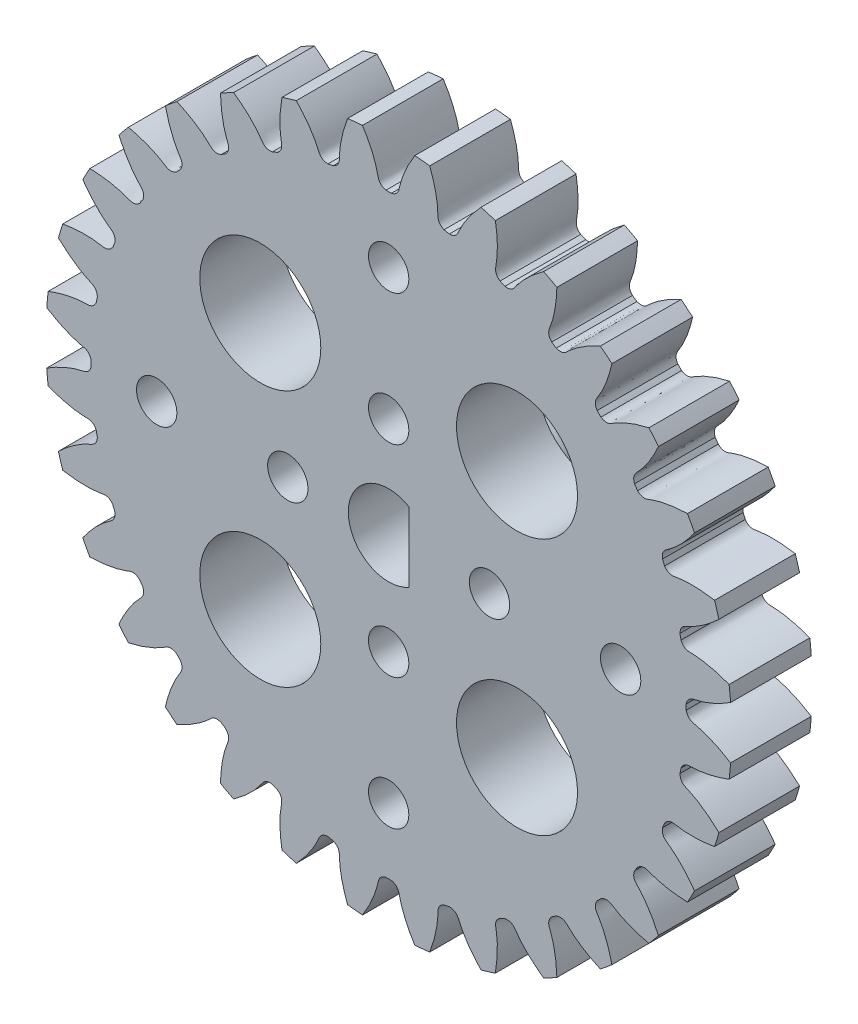
from build123d import *

# Parameters (mm, degrees)
SKETCH_1_R      = 2
SKETCH_1_R_2    = 1
SKETCH_1_R_3    = 3
EXTRUDE_1_DEPTH = 4
EXTRUDE_START   = -8
SKETCH_2_R      = 3.25
EXTRUDE_2_DEPTH = 8


with BuildPart() as part:
    # 草图1 → 凸台-拉伸1 (new body)
    with BuildSketch(Plane.XY):
        with BuildLine():
            ThreePointArc((-500.862133086, -21.020334667), (-500.887684173, -20.888759136), (-500.914429822, -20.757421219))
            add(Edge.make_bspline(
                [(-500.914429822, -20.757421219), (-500.899514244, -20.392716239), (-500.651028529, -20.323354985), (-500.400528124, -20.207194988), (-500.340474134, -20.17798022), (-500.250507683, -20.13192645), (-500.126698388, -20.063635499), (-499.966068811, -19.966494694), (-499.789360259, -19.849770094), (-499.597915128, -19.712040415), (-499.393161686, -19.55196308), (-499.185486348, -19.37580509), (-499.048497435, -19.250456147), (-498.982413871, -19.187867496)],
                knots=[0, 0, 0, 0, 0.124532679, 0.135328735, 0.147193327, 0.160126453, 0.189198313, 0.222544314, 0.260164456, 0.302058739, 0.348227164, 0.39866973, 0.447184516, 0.447184516, 0.447184516, 0.447184516], degree=3))
            ThreePointArc((-498.982413871, -19.187867496), (-499.086281352, -18.831501873), (-499.19790483, -18.477489006))
            add(Edge.make_bspline(
                [(-501.676314712, -18.245823332), (-501.461293631, -18.54077779), (-501.216150262, -18.460398297), (-500.943331751, -18.417811237), (-500.877167827, -18.40873822), (-500.776777353, -18.397047848), (-500.635893267, -18.385044939), (-500.448366115, -18.376573555), (-500.236589611, -18.375452502), (-500.000890292, -18.383609329), (-499.741709825, -18.402953851), (-499.471165957, -18.434045631), (-499.287623697, -18.462162506), (-499.19790483, -18.477489006)],
                knots=[0, 0, 0, 0, 0.124532679, 0.135328735, 0.147193327, 0.160126453, 0.189198313, 0.222544314, 0.260164456, 0.302058739, 0.348227164, 0.39866973, 0.447184516, 0.447184516, 0.447184516, 0.447184516], degree=3))
            ThreePointArc((-501.676314712, -18.245823332), (-501.727043955, -18.121760759), (-501.77889845, -17.99816428))
            add(Edge.make_bspline(
                [(-501.77889845, -17.99816428), (-501.835419883, -17.637557119), (-501.60524046, -17.521051464), (-501.382215042, -17.358253244), (-501.32901449, -17.317883877), (-501.249761364, -17.255163433), (-501.141653934, -17.164030679), (-501.00306204, -17.037419131), (-500.852520733, -16.888463233), (-500.691623894, -16.716030899), (-500.522034271, -16.519083991), (-500.352716075, -16.305795378), (-500.242813732, -16.156129769), (-500.190210384, -16.081851477)],
                knots=[0, 0, 0, 0, 0.124532679, 0.135328735, 0.147193327, 0.160126453, 0.189198313, 0.222544314, 0.260164456, 0.302058739, 0.348227164, 0.39866973, 0.447184516, 0.447184516, 0.447184516, 0.447184516], degree=3))
            ThreePointArc((-500.190210384, -16.081851477), (-500.361605565, -15.75259686), (-500.540148714, -15.427162911))
            add(Edge.make_bspline(
                [(-503.016132376, -15.683462411), (-502.747700105, -15.930800869), (-502.522948357, -15.804140747), (-502.263680301, -15.709147734), (-502.200557757, -15.687341111), (-502.104376936, -15.656290157), (-501.968541549, -15.617032759), (-501.786270364, -15.572139418), (-501.578781793, -15.529724359), (-501.346020052, -15.491741799), (-501.088045736, -15.46015102), (-500.816634587, -15.43786489), (-500.63113371, -15.429634188), (-500.540148714, -15.427162911)],
                knots=[0, 0, 0, 0, 0.124532679, 0.135328735, 0.147193327, 0.160126453, 0.189198313, 0.222544314, 0.260164456, 0.302058739, 0.348227164, 0.39866973, 0.447184516, 0.447184516, 0.447184516, 0.447184516], degree=3))
            ThreePointArc((-503.016132376, -15.683462411), (-503.090090278, -15.571680449), (-503.165060881, -15.460575152))
            add(Edge.make_bspline(
                [(-503.165060881, -15.460575152), (-503.290847237, -15.117923741), (-503.087819773, -14.958750932), (-502.900840082, -14.755570733), (-502.856537438, -14.70559814), (-502.79104329, -14.628621334), (-502.702792232, -14.518148957), (-502.59156403, -14.366932277), (-502.472975186, -14.191469373), (-502.348809815, -13.990960861), (-502.220901244, -13.764712938), (-502.096446994, -13.522490266), (-502.017854705, -13.354259555), (-501.980753092, -13.271146096)],
                knots=[0, 0, 0, 0, 0.124532679, 0.135328735, 0.147193327, 0.160126453, 0.189198313, 0.222544314, 0.260164456, 0.302058739, 0.348227164, 0.39866973, 0.447184516, 0.447184516, 0.447184516, 0.447184516], degree=3))
            ThreePointArc((-501.980753092, -13.271146096), (-502.213089352, -12.981655555), (-502.451690858, -12.697306769))
            add(Edge.make_bspline(
                [(-504.830097636, -13.431721995), (-504.518569876, -13.621939376), (-504.322846835, -13.453866102), (-504.087092759, -13.310117665), (-504.029437358, -13.276415452), (-503.941162365, -13.227197186), (-503.815595756, -13.162193939), (-503.645585117, -13.082603867), (-503.450358148, -13.000524789), (-503.229478888, -12.91786249), (-502.982624532, -12.836550427), (-502.72077628, -12.76174283), (-502.54044548, -12.717480853), (-502.451690858, -12.697306769)],
                knots=[0, 0, 0, 0, 0.124532679, 0.135328735, 0.147193327, 0.160126453, 0.189198313, 0.222544314, 0.260164456, 0.302058739, 0.348227164, 0.39866973, 0.447184516, 0.447184516, 0.447184516, 0.447184516], degree=3))
            ThreePointArc((-504.830097636, -13.431721995), (-504.924442037, -13.336516364), (-505.019647668, -13.242171963))
            add(Edge.make_bspline(
                [(-505.019647668, -13.242171963), (-505.209865049, -12.930644203), (-505.041791776, -12.734921162), (-504.898043338, -12.499167086), (-504.864341126, -12.441511685), (-504.815122859, -12.353236692), (-504.750119612, -12.227670083), (-504.67052954, -12.057659443), (-504.588450462, -11.862432474), (-504.505788163, -11.641553215), (-504.4244761, -11.394698858), (-504.349668503, -11.132850607), (-504.305406527, -10.952519807), (-504.285232442, -10.863765185)],
                knots=[0, 0, 0, 0, 0.124532679, 0.135328735, 0.147193327, 0.160126453, 0.189198313, 0.222544314, 0.260164456, 0.302058739, 0.348227164, 0.39866973, 0.447184516, 0.447184516, 0.447184516, 0.447184516], degree=3))
            ThreePointArc((-504.285232442, -10.863765185), (-504.569581229, -10.625163679), (-504.859071769, -10.392827419))
            add(Edge.make_bspline(
                [(-507.048500826, -11.577135207), (-506.705849414, -11.702921564), (-506.546676605, -11.499894099), (-506.343496406, -11.312914409), (-506.293523813, -11.268611765), (-506.216547007, -11.203117617), (-506.10607463, -11.114866559), (-505.95485795, -11.003638357), (-505.779395046, -10.885049513), (-505.578886535, -10.760884141), (-505.352638611, -10.632975571), (-505.110415939, -10.508521321), (-504.942185228, -10.429929032), (-504.859071769, -10.392827419)],
                knots=[0, 0, 0, 0, 0.124532679, 0.135328735, 0.147193327, 0.160126453, 0.189198313, 0.222544314, 0.260164456, 0.302058739, 0.348227164, 0.39866973, 0.447184516, 0.447184516, 0.447184516, 0.447184516], degree=3))
            ThreePointArc((-507.048500826, -11.577135207), (-507.159606122, -11.502164605), (-507.271388084, -11.428206703))
            add(Edge.make_bspline(
                [(-507.271388084, -11.428206703), (-507.518726542, -11.159774432), (-507.39206642, -10.935022684), (-507.297073407, -10.675754628), (-507.275266784, -10.612632083), (-507.24421583, -10.516451263), (-507.204958432, -10.380615876), (-507.160065091, -10.198344691), (-507.117650032, -9.990856119), (-507.079667472, -9.758094379), (-507.048076693, -9.500120063), (-507.025790563, -9.228708913), (-507.017559862, -9.043208037), (-507.015088584, -8.95222304)],
                knots=[0, 0, 0, 0, 0.124532679, 0.135328735, 0.147193327, 0.160126453, 0.189198313, 0.222544314, 0.260164456, 0.302058739, 0.348227164, 0.39866973, 0.447184516, 0.447184516, 0.447184516, 0.447184516], degree=3))
            ThreePointArc((-507.015088584, -8.95222304), (-507.340522533, -8.773679892), (-507.66977715, -8.602284711))
            add(Edge.make_bspline(
                [(-509.586089953, -10.190972777), (-509.225482792, -10.24749421), (-509.108977137, -10.017314787), (-508.946178917, -9.794289368), (-508.90580955, -9.741088817), (-508.843089107, -9.661835691), (-508.751956352, -9.553728261), (-508.625344804, -9.415136367), (-508.476388907, -9.26459506), (-508.303956572, -9.103698221), (-508.107009664, -8.934108598), (-507.893721051, -8.764790402), (-507.744055442, -8.654888059), (-507.66977715, -8.602284711)],
                knots=[0, 0, 0, 0, 0.124532679, 0.135328735, 0.147193327, 0.160126453, 0.189198313, 0.222544314, 0.260164456, 0.302058739, 0.348227164, 0.39866973, 0.447184516, 0.447184516, 0.447184516, 0.447184516], degree=3))
            ThreePointArc((-509.586089953, -10.190972777), (-509.709686432, -10.139118282), (-509.833749005, -10.088389039))
            add(Edge.make_bspline(
                [(-509.833749005, -10.088389039), (-510.128703463, -9.873367958), (-510.048323971, -9.628224588), (-510.00573691, -9.355406077), (-509.996663893, -9.289242154), (-509.984973521, -9.18885168), (-509.972970612, -9.047967594), (-509.964499229, -8.860440442), (-509.963378175, -8.648663938), (-509.971535002, -8.412964619), (-509.990879524, -8.153784152), (-510.021971304, -7.883240283), (-510.050088179, -7.699698024), (-510.065414679, -7.609979156)],
                knots=[0, 0, 0, 0, 0.124532679, 0.135328735, 0.147193327, 0.160126453, 0.189198313, 0.222544314, 0.260164456, 0.302058739, 0.348227164, 0.39866973, 0.447184516, 0.447184516, 0.447184516, 0.447184516], degree=3))
            ThreePointArc((-510.065414679, -7.609979156), (-510.419427546, -7.498355679), (-510.775793169, -7.394488197))
            add(Edge.make_bspline(
                [(-512.345346892, -9.326504149), (-511.980641912, -9.311588571), (-511.911280659, -9.063102855), (-511.795120661, -8.812602451), (-511.765905893, -8.752548461), (-511.719852123, -8.66258201), (-511.651561172, -8.538772715), (-511.554420367, -8.378143138), (-511.437695767, -8.201434586), (-511.299966088, -8.009989455), (-511.139888753, -7.805236013), (-510.963730763, -7.597560675), (-510.83838182, -7.460571762), (-510.775793169, -7.394488197)],
                knots=[0, 0, 0, 0, 0.124532679, 0.135328735, 0.147193327, 0.160126453, 0.189198313, 0.222544314, 0.260164456, 0.302058739, 0.348227164, 0.39866973, 0.447184516, 0.447184516, 0.447184516, 0.447184516], degree=3))
            ThreePointArc((-512.345346892, -9.326504149), (-512.47668481, -9.2997585), (-512.60826034, -9.274207413))
            add(Edge.make_bspline(
                [(-512.60826034, -9.274207413), (-512.939495862, -9.120860662), (-512.908485938, -8.864746393), (-512.919941427, -8.588861689), (-512.923950686, -8.522199029), (-512.932070152, -8.421456852), (-512.947782997, -8.280938163), (-512.976059121, -8.095361607), (-513.016275155, -7.887435623), (-513.070257907, -7.657856518), (-513.13979433, -7.40743006), (-513.22306918, -7.148150321), (-513.286453116, -6.973620105), (-513.318988404, -6.888615212)],
                knots=[0, 0, 0, 0, 0.124532679, 0.135328735, 0.147193327, 0.160126453, 0.189198313, 0.222544314, 0.260164456, 0.302058739, 0.348227164, 0.39866973, 0.447184516, 0.447184516, 0.447184516, 0.447184516], degree=3))
            ThreePointArc((-513.318988404, -6.888615212), (-513.687975674, -6.848201033), (-514.057757371, -6.81585282))
            add(Edge.make_bspline(
                [(-515.220234946, -9.016950368), (-514.865447555, -8.931170977), (-514.845896216, -8.673928135), (-514.780838405, -8.405579335), (-514.763900943, -8.340979747), (-514.736283667, -8.243757331), (-514.693458903, -8.109004093), (-514.629521907, -7.932509737), (-514.549514266, -7.736424751), (-514.451780116, -7.521788457), (-514.334724038, -7.289739756), (-514.202466323, -7.051688122), (-514.106251135, -6.892877048), (-514.057757371, -6.81585282)],
                knots=[0, 0, 0, 0, 0.124532679, 0.135328735, 0.147193327, 0.160126453, 0.189198313, 0.222544314, 0.260164456, 0.302058739, 0.348227164, 0.39866973, 0.447184516, 0.447184516, 0.447184516, 0.447184516], degree=3))
            ThreePointArc((-515.220234946, -9.016950368), (-515.354267059, -9.016341386), (-515.488299173, -9.016950368))
            add(Edge.make_bspline(
                [(-515.488299173, -9.016950368), (-515.843086564, -8.931170977), (-515.862637902, -8.673928135), (-515.927695713, -8.405579335), (-515.944633175, -8.340979747), (-515.972250451, -8.243757331), (-516.015075215, -8.109004093), (-516.079012211, -7.932509737), (-516.159019852, -7.736424751), (-516.256754002, -7.521788457), (-516.373810081, -7.289739756), (-516.506067796, -7.051688122), (-516.602282984, -6.892877048), (-516.650776747, -6.81585282)],
                knots=[0, 0, 0, 0, 0.124532679, 0.135328735, 0.147193327, 0.160126453, 0.189198313, 0.222544314, 0.260164456, 0.302058739, 0.348227164, 0.39866973, 0.447184516, 0.447184516, 0.447184516, 0.447184516], degree=3))
            ThreePointArc((-516.650776747, -6.81585282), (-517.020558445, -6.848201033), (-517.389545714, -6.888615212))
            add(Edge.make_bspline(
                [(-518.100273779, -9.274207413), (-517.769038257, -9.120860662), (-517.800048181, -8.864746393), (-517.788592691, -8.588861689), (-517.784583432, -8.522199029), (-517.776463967, -8.421456852), (-517.760751121, -8.280938163), (-517.732474997, -8.095361607), (-517.692258964, -7.887435623), (-517.638276212, -7.657856518), (-517.568739789, -7.40743006), (-517.485464938, -7.148150321), (-517.422081002, -6.973620105), (-517.389545714, -6.888615212)],
                knots=[0, 0, 0, 0, 0.124532679, 0.135328735, 0.147193327, 0.160126453, 0.189198313, 0.222544314, 0.260164456, 0.302058739, 0.348227164, 0.39866973, 0.447184516, 0.447184516, 0.447184516, 0.447184516], degree=3))
            ThreePointArc((-518.100273779, -9.274207413), (-518.231849309, -9.2997585), (-518.363187226, -9.326504149))
            add(Edge.make_bspline(
                [(-518.363187226, -9.326504149), (-518.727892206, -9.311588571), (-518.79725346, -9.063102855), (-518.913413457, -8.812602451), (-518.942628225, -8.752548461), (-518.988681995, -8.66258201), (-519.056972946, -8.538772715), (-519.154113752, -8.378143138), (-519.270838351, -8.201434586), (-519.408568031, -8.009989455), (-519.568645365, -7.805236013), (-519.744803355, -7.597560675), (-519.870152299, -7.460571762), (-519.93274095, -7.394488197)],
                knots=[0, 0, 0, 0, 0.124532679, 0.135328735, 0.147193327, 0.160126453, 0.189198313, 0.222544314, 0.260164456, 0.302058739, 0.348227164, 0.39866973, 0.447184516, 0.447184516, 0.447184516, 0.447184516], degree=3))
            ThreePointArc((-519.93274095, -7.394488197), (-520.289106573, -7.498355679), (-520.64311944, -7.609979156))
            add(Edge.make_bspline(
                [(-520.874785113, -10.088389039), (-520.579830656, -9.873367958), (-520.660210148, -9.628224588), (-520.702797208, -9.355406077), (-520.711870226, -9.289242154), (-520.723560598, -9.18885168), (-520.735563506, -9.047967594), (-520.74403489, -8.860440442), (-520.745155944, -8.648663938), (-520.736999116, -8.412964619), (-520.717654595, -8.153784152), (-520.686562815, -7.883240283), (-520.65844594, -7.699698024), (-520.64311944, -7.609979156)],
                knots=[0, 0, 0, 0, 0.124532679, 0.135328735, 0.147193327, 0.160126453, 0.189198313, 0.222544314, 0.260164456, 0.302058739, 0.348227164, 0.39866973, 0.447184516, 0.447184516, 0.447184516, 0.447184516], degree=3))
            ThreePointArc((-520.874785113, -10.088389039), (-520.998847687, -10.139118282), (-521.122444165, -10.190972777))
            add(Edge.make_bspline(
                [(-521.122444165, -10.190972777), (-521.483051327, -10.24749421), (-521.599556982, -10.017314787), (-521.762355202, -9.794289368), (-521.802724568, -9.741088817), (-521.865445012, -9.661835691), (-521.956577766, -9.553728261), (-522.083189314, -9.415136367), (-522.232145212, -9.26459506), (-522.404577547, -9.103698221), (-522.601524455, -8.934108598), (-522.814813067, -8.764790402), (-522.964478677, -8.654888059), (-523.038756968, -8.602284711)],
                knots=[0, 0, 0, 0, 0.124532679, 0.135328735, 0.147193327, 0.160126453, 0.189198313, 0.222544314, 0.260164456, 0.302058739, 0.348227164, 0.39866973, 0.447184516, 0.447184516, 0.447184516, 0.447184516], degree=3))
            ThreePointArc((-523.038756968, -8.602284711), (-523.368011585, -8.773679892), (-523.693445534, -8.95222304))
            add(Edge.make_bspline(
                [(-523.437146035, -11.428206703), (-523.189807577, -11.159774432), (-523.316467698, -10.935022684), (-523.411460711, -10.675754628), (-523.433267334, -10.612632083), (-523.464318289, -10.516451263), (-523.503575687, -10.380615876), (-523.548469028, -10.198344691), (-523.590884087, -9.990856119), (-523.628866647, -9.758094379), (-523.660457425, -9.500120063), (-523.682743556, -9.228708913), (-523.690974257, -9.043208037), (-523.693445534, -8.95222304)],
                knots=[0, 0, 0, 0, 0.124532679, 0.135328735, 0.147193327, 0.160126453, 0.189198313, 0.222544314, 0.260164456, 0.302058739, 0.348227164, 0.39866973, 0.447184516, 0.447184516, 0.447184516, 0.447184516], degree=3))
            ThreePointArc((-523.437146035, -11.428206703), (-523.548927996, -11.502164605), (-523.660033293, -11.577135207))
            add(Edge.make_bspline(
                [(-523.660033293, -11.577135207), (-524.002684704, -11.702921564), (-524.161857514, -11.499894099), (-524.365037712, -11.312914409), (-524.415010305, -11.268611765), (-524.491987111, -11.203117617), (-524.602459489, -11.114866559), (-524.753676169, -11.003638357), (-524.929139073, -10.885049513), (-525.129647584, -10.760884141), (-525.355895507, -10.632975571), (-525.59811818, -10.508521321), (-525.76634889, -10.429929032), (-525.849462349, -10.392827419)],
                knots=[0, 0, 0, 0, 0.124532679, 0.135328735, 0.147193327, 0.160126453, 0.189198313, 0.222544314, 0.260164456, 0.302058739, 0.348227164, 0.39866973, 0.447184516, 0.447184516, 0.447184516, 0.447184516], degree=3))
            ThreePointArc((-525.849462349, -10.392827419), (-526.13895289, -10.625163679), (-526.423301677, -10.863765185))
            add(Edge.make_bspline(
                [(-525.68888645, -13.242171963), (-525.498669069, -12.930644203), (-525.666742343, -12.734921162), (-525.810490781, -12.499167086), (-525.844192993, -12.441511685), (-525.893411259, -12.353236692), (-525.958414506, -12.227670083), (-526.038004579, -12.057659443), (-526.120083657, -11.862432474), (-526.202745956, -11.641553215), (-526.284058019, -11.394698858), (-526.358865616, -11.132850607), (-526.403127592, -10.952519807), (-526.423301677, -10.863765185)],
                knots=[0, 0, 0, 0, 0.124532679, 0.135328735, 0.147193327, 0.160126453, 0.189198313, 0.222544314, 0.260164456, 0.302058739, 0.348227164, 0.39866973, 0.447184516, 0.447184516, 0.447184516, 0.447184516], degree=3))
            ThreePointArc((-525.68888645, -13.242171963), (-525.784092082, -13.336516364), (-525.878436482, -13.431721995))
            add(Edge.make_bspline(
                [(-525.878436482, -13.431721995), (-526.189964242, -13.621939376), (-526.385687284, -13.453866102), (-526.62144136, -13.310117665), (-526.679096761, -13.276415452), (-526.767371754, -13.227197186), (-526.892938363, -13.162193939), (-527.062949002, -13.082603867), (-527.258175971, -13.000524789), (-527.47905523, -12.91786249), (-527.725909587, -12.836550427), (-527.987757839, -12.76174283), (-528.168088638, -12.717480853), (-528.256843261, -12.697306769)],
                knots=[0, 0, 0, 0, 0.124532679, 0.135328735, 0.147193327, 0.160126453, 0.189198313, 0.222544314, 0.260164456, 0.302058739, 0.348227164, 0.39866973, 0.447184516, 0.447184516, 0.447184516, 0.447184516], degree=3))
            ThreePointArc((-528.256843261, -12.697306769), (-528.495444766, -12.981655555), (-528.727781026, -13.271146096))
            add(Edge.make_bspline(
                [(-527.543473238, -15.460575152), (-527.417686882, -15.117923741), (-527.620714346, -14.958750932), (-527.807694036, -14.755570733), (-527.851996681, -14.70559814), (-527.917490829, -14.628621334), (-528.005741887, -14.518148957), (-528.116970089, -14.366932277), (-528.235558932, -14.191469373), (-528.359724304, -13.990960861), (-528.487632875, -13.764712938), (-528.612087125, -13.522490266), (-528.690679413, -13.354259555), (-528.727781026, -13.271146096)],
                knots=[0, 0, 0, 0, 0.124532679, 0.135328735, 0.147193327, 0.160126453, 0.189198313, 0.222544314, 0.260164456, 0.302058739, 0.348227164, 0.39866973, 0.447184516, 0.447184516, 0.447184516, 0.447184516], degree=3))
            ThreePointArc((-527.543473238, -15.460575152), (-527.618443841, -15.571680449), (-527.692401743, -15.683462411))
            add(Edge.make_bspline(
                [(-527.692401743, -15.683462411), (-527.960834014, -15.930800869), (-528.185585761, -15.804140747), (-528.444853818, -15.709147734), (-528.507976362, -15.687341111), (-528.604157183, -15.656290157), (-528.739992569, -15.617032759), (-528.922263755, -15.572139418), (-529.129752326, -15.529724359), (-529.362514067, -15.491741799), (-529.620488383, -15.46015102), (-529.891899532, -15.43786489), (-530.077400409, -15.429634188), (-530.168385405, -15.427162911)],
                knots=[0, 0, 0, 0, 0.124532679, 0.135328735, 0.147193327, 0.160126453, 0.189198313, 0.222544314, 0.260164456, 0.302058739, 0.348227164, 0.39866973, 0.447184516, 0.447184516, 0.447184516, 0.447184516], degree=3))
            ThreePointArc((-530.168385405, -15.427162911), (-530.346928553, -15.75259686), (-530.518323734, -16.081851477))
            add(Edge.make_bspline(
                [(-528.929635668, -17.99816428), (-528.873114236, -17.637557119), (-529.103293659, -17.521051464), (-529.326319077, -17.358253244), (-529.379519628, -17.317883877), (-529.458772754, -17.255163433), (-529.566880185, -17.164030679), (-529.705472079, -17.037419131), (-529.856013385, -16.888463233), (-530.016910224, -16.716030899), (-530.186499848, -16.519083991), (-530.355818043, -16.305795378), (-530.465720387, -16.156129769), (-530.518323734, -16.081851477)],
                knots=[0, 0, 0, 0, 0.124532679, 0.135328735, 0.147193327, 0.160126453, 0.189198313, 0.222544314, 0.260164456, 0.302058739, 0.348227164, 0.39866973, 0.447184516, 0.447184516, 0.447184516, 0.447184516], degree=3))
            ThreePointArc((-528.929635668, -17.99816428), (-528.981490164, -18.121760759), (-529.032219407, -18.245823332))
            add(Edge.make_bspline(
                [(-529.032219407, -18.245823332), (-529.247240488, -18.54077779), (-529.492383857, -18.460398297), (-529.765202368, -18.417811237), (-529.831366291, -18.40873822), (-529.931756765, -18.397047848), (-530.072640851, -18.385044939), (-530.260168003, -18.376573555), (-530.471944508, -18.375452502), (-530.707643826, -18.383609329), (-530.966824294, -18.402953851), (-531.237368162, -18.434045631), (-531.420910422, -18.462162506), (-531.510629289, -18.477489006)],
                knots=[0, 0, 0, 0, 0.124532679, 0.135328735, 0.147193327, 0.160126453, 0.189198313, 0.222544314, 0.260164456, 0.302058739, 0.348227164, 0.39866973, 0.447184516, 0.447184516, 0.447184516, 0.447184516], degree=3))
            ThreePointArc((-531.510629289, -18.477489006), (-531.622252767, -18.831501873), (-531.726120248, -19.187867496))
            add(Edge.make_bspline(
                [(-529.794104296, -20.757421219), (-529.809019874, -20.392716239), (-530.05750559, -20.323354985), (-530.308005995, -20.207194988), (-530.368059985, -20.17798022), (-530.458026436, -20.13192645), (-530.581835731, -20.063635499), (-530.742465308, -19.966494694), (-530.91917386, -19.849770094), (-531.110618991, -19.712040415), (-531.315372433, -19.55196308), (-531.523047771, -19.37580509), (-531.660036683, -19.250456147), (-531.726120248, -19.187867496)],
                knots=[0, 0, 0, 0, 0.124532679, 0.135328735, 0.147193327, 0.160126453, 0.189198313, 0.222544314, 0.260164456, 0.302058739, 0.348227164, 0.39866973, 0.447184516, 0.447184516, 0.447184516, 0.447184516], degree=3))
            ThreePointArc((-529.794104296, -20.757421219), (-529.820849945, -20.888759136), (-529.846401033, -21.020334667))
            add(Edge.make_bspline(
                [(-529.846401033, -21.020334667), (-529.999747784, -21.351570189), (-530.255862053, -21.320560265), (-530.531746756, -21.332015754), (-530.598409416, -21.336025013), (-530.699151594, -21.344144479), (-530.839670283, -21.359857324), (-531.025246838, -21.388133448), (-531.233172823, -21.428349482), (-531.462751927, -21.482332234), (-531.713178386, -21.551868657), (-531.972458124, -21.635143507), (-532.146988341, -21.698527443), (-532.231993233, -21.731062731)],
                knots=[0, 0, 0, 0, 0.124532679, 0.135328735, 0.147193327, 0.160126453, 0.189198313, 0.222544314, 0.260164456, 0.302058739, 0.348227164, 0.39866973, 0.447184516, 0.447184516, 0.447184516, 0.447184516], degree=3))
            ThreePointArc((-532.231993233, -21.731062731), (-532.272407413, -22.100050001), (-532.304755625, -22.469831698))
            add(Edge.make_bspline(
                [(-530.103658077, -23.632309273), (-530.189437469, -23.277521882), (-530.44668031, -23.257970543), (-530.715029111, -23.192912732), (-530.779628699, -23.17597527), (-530.876851115, -23.148357994), (-531.011604352, -23.10553323), (-531.188098708, -23.041596234), (-531.384183695, -22.961588593), (-531.598819989, -22.863854443), (-531.830868689, -22.746798365), (-532.068920323, -22.614540649), (-532.227731398, -22.518325462), (-532.304755625, -22.469831698)],
                knots=[0, 0, 0, 0, 0.124532679, 0.135328735, 0.147193327, 0.160126453, 0.189198313, 0.222544314, 0.260164456, 0.302058739, 0.348227164, 0.39866973, 0.447184516, 0.447184516, 0.447184516, 0.447184516], degree=3))
            ThreePointArc((-530.103658077, -23.632309273), (-530.104267059, -23.766341386), (-530.103658077, -23.900373499))
            add(Edge.make_bspline(
                [(-530.103658077, -23.900373499), (-530.189437469, -24.255160891), (-530.44668031, -24.274712229), (-530.715029111, -24.33977004), (-530.779628699, -24.356707502), (-530.876851115, -24.384324778), (-531.011604352, -24.427149542), (-531.188098708, -24.491086538), (-531.384183695, -24.571094179), (-531.598819989, -24.668828329), (-531.830868689, -24.785884408), (-532.068920323, -24.918142123), (-532.227731398, -25.01435731), (-532.304755625, -25.062851074)],
                knots=[0, 0, 0, 0, 0.124532679, 0.135328735, 0.147193327, 0.160126453, 0.189198313, 0.222544314, 0.260164456, 0.302058739, 0.348227164, 0.39866973, 0.447184516, 0.447184516, 0.447184516, 0.447184516], degree=3))
            ThreePointArc((-532.304755625, -25.062851074), (-532.272407413, -25.432632772), (-532.231993233, -25.801620041))
            add(Edge.make_bspline(
                [(-529.846401033, -26.512348106), (-529.999747784, -26.181112584), (-530.255862053, -26.212122508), (-530.531746756, -26.200667018), (-530.598409416, -26.196657759), (-530.699151594, -26.188538294), (-530.839670283, -26.172825448), (-531.025246838, -26.144549324), (-531.233172823, -26.104333291), (-531.462751927, -26.050350539), (-531.713178386, -25.980814116), (-531.972458124, -25.897539265), (-532.146988341, -25.834155329), (-532.231993233, -25.801620041)],
                knots=[0, 0, 0, 0, 0.124532679, 0.135328735, 0.147193327, 0.160126453, 0.189198313, 0.222544314, 0.260164456, 0.302058739, 0.348227164, 0.39866973, 0.447184516, 0.447184516, 0.447184516, 0.447184516], degree=3))
            ThreePointArc((-529.846401033, -26.512348106), (-529.820849945, -26.643923636), (-529.794104296, -26.775261553))
            add(Edge.make_bspline(
                [(-529.794104296, -26.775261553), (-529.809019874, -27.139966533), (-530.05750559, -27.209327787), (-530.308005995, -27.325487784), (-530.368059985, -27.354702552), (-530.458026436, -27.400756322), (-530.581835731, -27.469047273), (-530.742465308, -27.566188078), (-530.91917386, -27.682912678), (-531.110618991, -27.820642358), (-531.315372433, -27.980719692), (-531.523047771, -28.156877682), (-531.660036683, -28.282226626), (-531.726120248, -28.344815277)],
                knots=[0, 0, 0, 0, 0.124532679, 0.135328735, 0.147193327, 0.160126453, 0.189198313, 0.222544314, 0.260164456, 0.302058739, 0.348227164, 0.39866973, 0.447184516, 0.447184516, 0.447184516, 0.447184516], degree=3))
            ThreePointArc((-531.726120248, -28.344815277), (-531.622252767, -28.7011809), (-531.510629289, -29.055193767))
            add(Edge.make_bspline(
                [(-529.032219407, -29.28685944), (-529.247240488, -28.991904983), (-529.492383857, -29.072284475), (-529.765202368, -29.114871535), (-529.831366291, -29.123944553), (-529.931756765, -29.135634925), (-530.072640851, -29.147637833), (-530.260168003, -29.156109217), (-530.471944508, -29.15723027), (-530.707643826, -29.149073443), (-530.966824294, -29.129728922), (-531.237368162, -29.098637142), (-531.420910422, -29.070520266), (-531.510629289, -29.055193767)],
                knots=[0, 0, 0, 0, 0.124532679, 0.135328735, 0.147193327, 0.160126453, 0.189198313, 0.222544314, 0.260164456, 0.302058739, 0.348227164, 0.39866973, 0.447184516, 0.447184516, 0.447184516, 0.447184516], degree=3))
            ThreePointArc((-529.032219407, -29.28685944), (-528.981490164, -29.410922014), (-528.929635668, -29.534518492))
            add(Edge.make_bspline(
                [(-528.929635668, -29.534518492), (-528.873114236, -29.895125653), (-529.103293659, -30.011631308), (-529.326319077, -30.174429528), (-529.379519628, -30.214798895), (-529.458772754, -30.277519339), (-529.566880185, -30.368652093), (-529.705472079, -30.495263641), (-529.856013385, -30.644219539), (-530.016910224, -30.816651873), (-530.186499848, -31.013598782), (-530.355818043, -31.226887394), (-530.465720387, -31.376553004), (-530.518323734, -31.450831295)],
                knots=[0, 0, 0, 0, 0.124532679, 0.135328735, 0.147193327, 0.160126453, 0.189198313, 0.222544314, 0.260164456, 0.302058739, 0.348227164, 0.39866973, 0.447184516, 0.447184516, 0.447184516, 0.447184516], degree=3))
            ThreePointArc((-530.518323734, -31.450831295), (-530.346928553, -31.780085912), (-530.168385405, -32.105519861))
            add(Edge.make_bspline(
                [(-527.692401743, -31.849220362), (-527.960834014, -31.601881903), (-528.185585761, -31.728542025), (-528.444853818, -31.823535038), (-528.507976362, -31.845341661), (-528.604157183, -31.876392616), (-528.739992569, -31.915650013), (-528.922263755, -31.960543354), (-529.129752326, -32.002958414), (-529.362514067, -32.040940974), (-529.620488383, -32.072531752), (-529.891899532, -32.094817883), (-530.077400409, -32.103048584), (-530.168385405, -32.105519861)],
                knots=[0, 0, 0, 0, 0.124532679, 0.135328735, 0.147193327, 0.160126453, 0.189198313, 0.222544314, 0.260164456, 0.302058739, 0.348227164, 0.39866973, 0.447184516, 0.447184516, 0.447184516, 0.447184516], degree=3))
            ThreePointArc((-527.692401743, -31.849220362), (-527.618443841, -31.961002323), (-527.543473238, -32.07210762))
            add(Edge.make_bspline(
                [(-527.543473238, -32.07210762), (-527.417686882, -32.414759031), (-527.620714346, -32.57393184), (-527.807694036, -32.777112039), (-527.851996681, -32.827084632), (-527.917490829, -32.904061438), (-528.005741887, -33.014533816), (-528.116970089, -33.165750496), (-528.235558932, -33.341213399), (-528.359724304, -33.541721911), (-528.487632875, -33.767969834), (-528.612087125, -34.010192507), (-528.690679413, -34.178423217), (-528.727781026, -34.261536676)],
                knots=[0, 0, 0, 0, 0.124532679, 0.135328735, 0.147193327, 0.160126453, 0.189198313, 0.222544314, 0.260164456, 0.302058739, 0.348227164, 0.39866973, 0.447184516, 0.447184516, 0.447184516, 0.447184516], degree=3))
            ThreePointArc((-528.727781026, -34.261536676), (-528.495444766, -34.551027217), (-528.256843261, -34.835376004))
            add(Edge.make_bspline(
                [(-525.878436482, -34.100960777), (-526.189964242, -33.910743396), (-526.385687284, -34.07881667), (-526.62144136, -34.222565107), (-526.679096761, -34.25626732), (-526.767371754, -34.305485586), (-526.892938363, -34.370488833), (-527.062949002, -34.450078906), (-527.258175971, -34.532157984), (-527.47905523, -34.614820282), (-527.725909587, -34.696132345), (-527.987757839, -34.770939943), (-528.168088638, -34.815201919), (-528.256843261, -34.835376004)],
                knots=[0, 0, 0, 0, 0.124532679, 0.135328735, 0.147193327, 0.160126453, 0.189198313, 0.222544314, 0.260164456, 0.302058739, 0.348227164, 0.39866973, 0.447184516, 0.447184516, 0.447184516, 0.447184516], degree=3))
            ThreePointArc((-525.878436482, -34.100960777), (-525.784092082, -34.196166409), (-525.68888645, -34.290510809))
            add(Edge.make_bspline(
                [(-525.68888645, -34.290510809), (-525.498669069, -34.602038569), (-525.666742343, -34.797761611), (-525.810490781, -35.033515687), (-525.844192993, -35.091171088), (-525.893411259, -35.17944608), (-525.958414506, -35.305012689), (-526.038004579, -35.475023329), (-526.120083657, -35.670250298), (-526.202745956, -35.891129557), (-526.284058019, -36.137983914), (-526.358865616, -36.399832166), (-526.403127592, -36.580162965), (-526.423301677, -36.668917588)],
                knots=[0, 0, 0, 0, 0.124532679, 0.135328735, 0.147193327, 0.160126453, 0.189198313, 0.222544314, 0.260164456, 0.302058739, 0.348227164, 0.39866973, 0.447184516, 0.447184516, 0.447184516, 0.447184516], degree=3))
            ThreePointArc((-526.423301677, -36.668917588), (-526.13895289, -36.907519093), (-525.849462349, -37.139855353))
            add(Edge.make_bspline(
                [(-523.660033293, -35.955547565), (-524.002684704, -35.829761209), (-524.161857514, -36.032788673), (-524.365037712, -36.219768363), (-524.415010305, -36.264071008), (-524.491987111, -36.329565156), (-524.602459489, -36.417816214), (-524.753676169, -36.529044416), (-524.929139073, -36.647633259), (-525.129647584, -36.771798631), (-525.355895507, -36.899707201), (-525.59811818, -37.024161451), (-525.76634889, -37.10275374), (-525.849462349, -37.139855353)],
                knots=[0, 0, 0, 0, 0.124532679, 0.135328735, 0.147193327, 0.160126453, 0.189198313, 0.222544314, 0.260164456, 0.302058739, 0.348227164, 0.39866973, 0.447184516, 0.447184516, 0.447184516, 0.447184516], degree=3))
            ThreePointArc((-523.660033293, -35.955547565), (-523.548927996, -36.030518168), (-523.437146035, -36.10447607))
            add(Edge.make_bspline(
                [(-523.437146035, -36.10447607), (-523.189807577, -36.372908341), (-523.316467698, -36.597660088), (-523.411460711, -36.856928145), (-523.433267334, -36.920050689), (-523.464318289, -37.01623151), (-523.503575687, -37.152066896), (-523.548469028, -37.334338082), (-523.590884087, -37.541826653), (-523.628866647, -37.774588393), (-523.660457425, -38.03256271), (-523.682743556, -38.303973859), (-523.690974257, -38.489474736), (-523.693445534, -38.580459732)],
                knots=[0, 0, 0, 0, 0.124532679, 0.135328735, 0.147193327, 0.160126453, 0.189198313, 0.222544314, 0.260164456, 0.302058739, 0.348227164, 0.39866973, 0.447184516, 0.447184516, 0.447184516, 0.447184516], degree=3))
            ThreePointArc((-523.693445534, -38.580459732), (-523.368011585, -38.75900288), (-523.038756968, -38.930398061))
            add(Edge.make_bspline(
                [(-521.122444165, -37.341709995), (-521.483051327, -37.285188563), (-521.599556982, -37.515367986), (-521.762355202, -37.738393404), (-521.802724568, -37.791593955), (-521.865445012, -37.870847081), (-521.956577766, -37.978954512), (-522.083189314, -38.117546406), (-522.232145212, -38.268087712), (-522.404577547, -38.428984551), (-522.601524455, -38.598574175), (-522.814813067, -38.76789237), (-522.964478677, -38.877794714), (-523.038756968, -38.930398061)],
                knots=[0, 0, 0, 0, 0.124532679, 0.135328735, 0.147193327, 0.160126453, 0.189198313, 0.222544314, 0.260164456, 0.302058739, 0.348227164, 0.39866973, 0.447184516, 0.447184516, 0.447184516, 0.447184516], degree=3))
            ThreePointArc((-521.122444165, -37.341709995), (-520.998847687, -37.393564491), (-520.874785113, -37.444293734))
            add(Edge.make_bspline(
                [(-520.874785113, -37.444293734), (-520.579830656, -37.659314814), (-520.660210148, -37.904458184), (-520.702797208, -38.177276695), (-520.711870226, -38.243440618), (-520.723560598, -38.343831092), (-520.735563506, -38.484715178), (-520.74403489, -38.67224233), (-520.745155944, -38.884018834), (-520.736999116, -39.119718153), (-520.717654595, -39.37889862), (-520.686562815, -39.649442489), (-520.65844594, -39.832984749), (-520.64311944, -39.922703616)],
                knots=[0, 0, 0, 0, 0.124532679, 0.135328735, 0.147193327, 0.160126453, 0.189198313, 0.222544314, 0.260164456, 0.302058739, 0.348227164, 0.39866973, 0.447184516, 0.447184516, 0.447184516, 0.447184516], degree=3))
            ThreePointArc((-520.64311944, -39.922703616), (-520.289106573, -40.034327094), (-519.93274095, -40.138194575))
            add(Edge.make_bspline(
                [(-518.363187226, -38.206178623), (-518.727892206, -38.221094201), (-518.79725346, -38.469579917), (-518.913413457, -38.720080321), (-518.942628225, -38.780134312), (-518.988681995, -38.870100763), (-519.056972946, -38.993910058), (-519.154113752, -39.154539635), (-519.270838351, -39.331248187), (-519.408568031, -39.522693318), (-519.568645365, -39.72744676), (-519.744803355, -39.935122098), (-519.870152299, -40.07211101), (-519.93274095, -40.138194575)],
                knots=[0, 0, 0, 0, 0.124532679, 0.135328735, 0.147193327, 0.160126453, 0.189198313, 0.222544314, 0.260164456, 0.302058739, 0.348227164, 0.39866973, 0.447184516, 0.447184516, 0.447184516, 0.447184516], degree=3))
            ThreePointArc((-518.363187226, -38.206178623), (-518.231849309, -38.232924272), (-518.100273779, -38.258475359))
            add(Edge.make_bspline(
                [(-518.100273779, -38.258475359), (-517.769038257, -38.41182211), (-517.800048181, -38.66793638), (-517.788592691, -38.943821083), (-517.784583432, -39.010483743), (-517.776463967, -39.111225921), (-517.760751121, -39.251744609), (-517.732474997, -39.437321165), (-517.692258964, -39.64524715), (-517.638276212, -39.874826254), (-517.568739789, -40.125252712), (-517.485464938, -40.384532451), (-517.422081002, -40.559062667), (-517.389545714, -40.64406756)],
                knots=[0, 0, 0, 0, 0.124532679, 0.135328735, 0.147193327, 0.160126453, 0.189198313, 0.222544314, 0.260164456, 0.302058739, 0.348227164, 0.39866973, 0.447184516, 0.447184516, 0.447184516, 0.447184516], degree=3))
            ThreePointArc((-517.389545714, -40.64406756), (-517.020558445, -40.68448174), (-516.650776747, -40.716829952))
            add(Edge.make_bspline(
                [(-515.488299173, -38.515732404), (-515.843086564, -38.601511795), (-515.862637902, -38.858754637), (-515.927695713, -39.127103438), (-515.944633175, -39.191703026), (-515.972250451, -39.288925442), (-516.015075215, -39.423678679), (-516.079012211, -39.600173035), (-516.159019852, -39.796258021), (-516.256754002, -40.010894315), (-516.373810081, -40.242943016), (-516.506067796, -40.48099465), (-516.602282984, -40.639805725), (-516.650776747, -40.716829952)],
                knots=[0, 0, 0, 0, 0.124532679, 0.135328735, 0.147193327, 0.160126453, 0.189198313, 0.222544314, 0.260164456, 0.302058739, 0.348227164, 0.39866973, 0.447184516, 0.447184516, 0.447184516, 0.447184516], degree=3))
            ThreePointArc((-515.488299173, -38.515732404), (-515.354267059, -38.516341386), (-515.220234946, -38.515732404))
            add(Edge.make_bspline(
                [(-515.220234946, -38.515732404), (-514.865447555, -38.601511795), (-514.845896216, -38.858754637), (-514.780838405, -39.127103438), (-514.763900943, -39.191703026), (-514.736283667, -39.288925442), (-514.693458903, -39.423678679), (-514.629521907, -39.600173035), (-514.549514266, -39.796258021), (-514.451780116, -40.010894315), (-514.334724038, -40.242943016), (-514.202466323, -40.48099465), (-514.106251135, -40.639805725), (-514.057757371, -40.716829952)],
                knots=[0, 0, 0, 0, 0.124532679, 0.135328735, 0.147193327, 0.160126453, 0.189198313, 0.222544314, 0.260164456, 0.302058739, 0.348227164, 0.39866973, 0.447184516, 0.447184516, 0.447184516, 0.447184516], degree=3))
            ThreePointArc((-514.057757371, -40.716829952), (-513.687975674, -40.68448174), (-513.318988404, -40.64406756))
            add(Edge.make_bspline(
                [(-512.60826034, -38.258475359), (-512.939495862, -38.41182211), (-512.908485938, -38.66793638), (-512.919941427, -38.943821083), (-512.923950686, -39.010483743), (-512.932070152, -39.111225921), (-512.947782997, -39.251744609), (-512.976059121, -39.437321165), (-513.016275155, -39.64524715), (-513.070257907, -39.874826254), (-513.13979433, -40.125252712), (-513.22306918, -40.384532451), (-513.286453116, -40.559062667), (-513.318988404, -40.64406756)],
                knots=[0, 0, 0, 0, 0.124532679, 0.135328735, 0.147193327, 0.160126453, 0.189198313, 0.222544314, 0.260164456, 0.302058739, 0.348227164, 0.39866973, 0.447184516, 0.447184516, 0.447184516, 0.447184516], degree=3))
            ThreePointArc((-512.60826034, -38.258475359), (-512.47668481, -38.232924272), (-512.345346892, -38.206178623))
            add(Edge.make_bspline(
                [(-512.345346892, -38.206178623), (-511.980641912, -38.221094201), (-511.911280659, -38.469579917), (-511.795120661, -38.720080321), (-511.765905893, -38.780134312), (-511.719852123, -38.870100763), (-511.651561172, -38.993910058), (-511.554420367, -39.154539635), (-511.437695767, -39.331248187), (-511.299966088, -39.522693318), (-511.139888753, -39.72744676), (-510.963730763, -39.935122098), (-510.83838182, -40.07211101), (-510.775793169, -40.138194575)],
                knots=[0, 0, 0, 0, 0.124532679, 0.135328735, 0.147193327, 0.160126453, 0.189198313, 0.222544314, 0.260164456, 0.302058739, 0.348227164, 0.39866973, 0.447184516, 0.447184516, 0.447184516, 0.447184516], degree=3))
            ThreePointArc((-510.775793169, -40.138194575), (-510.419427546, -40.034327094), (-510.065414679, -39.922703616))
            add(Edge.make_bspline(
                [(-509.833749005, -37.444293734), (-510.128703463, -37.659314814), (-510.048323971, -37.904458184), (-510.00573691, -38.177276695), (-509.996663893, -38.243440618), (-509.984973521, -38.343831092), (-509.972970612, -38.484715178), (-509.964499229, -38.67224233), (-509.963378175, -38.884018834), (-509.971535002, -39.119718153), (-509.990879524, -39.37889862), (-510.021971304, -39.649442489), (-510.050088179, -39.832984749), (-510.065414679, -39.922703616)],
                knots=[0, 0, 0, 0, 0.124532679, 0.135328735, 0.147193327, 0.160126453, 0.189198313, 0.222544314, 0.260164456, 0.302058739, 0.348227164, 0.39866973, 0.447184516, 0.447184516, 0.447184516, 0.447184516], degree=3))
            ThreePointArc((-509.833749005, -37.444293734), (-509.709686432, -37.393564491), (-509.586089953, -37.341709995))
            add(Edge.make_bspline(
                [(-509.586089953, -37.341709995), (-509.225482792, -37.285188563), (-509.108977137, -37.515367986), (-508.946178917, -37.738393404), (-508.90580955, -37.791593955), (-508.843089107, -37.870847081), (-508.751956352, -37.978954512), (-508.625344804, -38.117546406), (-508.476388907, -38.268087712), (-508.303956572, -38.428984551), (-508.107009664, -38.598574175), (-507.893721051, -38.76789237), (-507.744055442, -38.877794714), (-507.66977715, -38.930398061)],
                knots=[0, 0, 0, 0, 0.124532679, 0.135328735, 0.147193327, 0.160126453, 0.189198313, 0.222544314, 0.260164456, 0.302058739, 0.348227164, 0.39866973, 0.447184516, 0.447184516, 0.447184516, 0.447184516], degree=3))
            ThreePointArc((-507.66977715, -38.930398061), (-507.340522533, -38.75900288), (-507.015088584, -38.580459732))
            add(Edge.make_bspline(
                [(-507.271388084, -36.10447607), (-507.518726542, -36.372908341), (-507.39206642, -36.597660088), (-507.297073407, -36.856928145), (-507.275266784, -36.920050689), (-507.24421583, -37.01623151), (-507.204958432, -37.152066896), (-507.160065091, -37.334338082), (-507.117650032, -37.541826653), (-507.079667472, -37.774588393), (-507.048076693, -38.03256271), (-507.025790563, -38.303973859), (-507.017559862, -38.489474736), (-507.015088584, -38.580459732)],
                knots=[0, 0, 0, 0, 0.124532679, 0.135328735, 0.147193327, 0.160126453, 0.189198313, 0.222544314, 0.260164456, 0.302058739, 0.348227164, 0.39866973, 0.447184516, 0.447184516, 0.447184516, 0.447184516], degree=3))
            ThreePointArc((-507.271388084, -36.10447607), (-507.159606122, -36.030518168), (-507.048500826, -35.955547565))
            add(Edge.make_bspline(
                [(-507.048500826, -35.955547565), (-506.705849414, -35.829761209), (-506.546676605, -36.032788673), (-506.343496406, -36.219768363), (-506.293523813, -36.264071008), (-506.216547007, -36.329565156), (-506.10607463, -36.417816214), (-505.95485795, -36.529044416), (-505.779395046, -36.647633259), (-505.578886535, -36.771798631), (-505.352638611, -36.899707201), (-505.110415939, -37.024161451), (-504.942185228, -37.10275374), (-504.859071769, -37.139855353)],
                knots=[0, 0, 0, 0, 0.124532679, 0.135328735, 0.147193327, 0.160126453, 0.189198313, 0.222544314, 0.260164456, 0.302058739, 0.348227164, 0.39866973, 0.447184516, 0.447184516, 0.447184516, 0.447184516], degree=3))
            ThreePointArc((-504.859071769, -37.139855353), (-504.569581229, -36.907519093), (-504.285232442, -36.668917588))
            add(Edge.make_bspline(
                [(-505.019647668, -34.290510809), (-505.209865049, -34.602038569), (-505.041791776, -34.797761611), (-504.898043338, -35.033515687), (-504.864341126, -35.091171088), (-504.815122859, -35.17944608), (-504.750119612, -35.305012689), (-504.67052954, -35.475023329), (-504.588450462, -35.670250298), (-504.505788163, -35.891129557), (-504.4244761, -36.137983914), (-504.349668503, -36.399832166), (-504.305406527, -36.580162965), (-504.285232442, -36.668917588)],
                knots=[0, 0, 0, 0, 0.124532679, 0.135328735, 0.147193327, 0.160126453, 0.189198313, 0.222544314, 0.260164456, 0.302058739, 0.348227164, 0.39866973, 0.447184516, 0.447184516, 0.447184516, 0.447184516], degree=3))
            ThreePointArc((-505.019647668, -34.290510809), (-504.924442037, -34.196166409), (-504.830097636, -34.100960777))
            add(Edge.make_bspline(
                [(-504.830097636, -34.100960777), (-504.518569876, -33.910743396), (-504.322846835, -34.07881667), (-504.087092759, -34.222565107), (-504.029437358, -34.25626732), (-503.941162365, -34.305485586), (-503.815595756, -34.370488833), (-503.645585117, -34.450078906), (-503.450358148, -34.532157984), (-503.229478888, -34.614820282), (-502.982624532, -34.696132345), (-502.72077628, -34.770939943), (-502.54044548, -34.815201919), (-502.451690858, -34.835376004)],
                knots=[0, 0, 0, 0, 0.124532679, 0.135328735, 0.147193327, 0.160126453, 0.189198313, 0.222544314, 0.260164456, 0.302058739, 0.348227164, 0.39866973, 0.447184516, 0.447184516, 0.447184516, 0.447184516], degree=3))
            ThreePointArc((-502.451690858, -34.835376004), (-502.213089352, -34.551027217), (-501.980753092, -34.261536676))
            add(Edge.make_bspline(
                [(-503.165060881, -32.07210762), (-503.290847237, -32.414759031), (-503.087819773, -32.57393184), (-502.900840082, -32.777112039), (-502.856537438, -32.827084632), (-502.79104329, -32.904061438), (-502.702792232, -33.014533816), (-502.59156403, -33.165750496), (-502.472975186, -33.341213399), (-502.348809815, -33.541721911), (-502.220901244, -33.767969834), (-502.096446994, -34.010192507), (-502.017854705, -34.178423217), (-501.980753092, -34.261536676)],
                knots=[0, 0, 0, 0, 0.124532679, 0.135328735, 0.147193327, 0.160126453, 0.189198313, 0.222544314, 0.260164456, 0.302058739, 0.348227164, 0.39866973, 0.447184516, 0.447184516, 0.447184516, 0.447184516], degree=3))
            ThreePointArc((-503.165060881, -32.07210762), (-503.090090278, -31.961002323), (-503.016132376, -31.849220362))
            add(Edge.make_bspline(
                [(-503.016132376, -31.849220362), (-502.747700105, -31.601881903), (-502.522948357, -31.728542025), (-502.263680301, -31.823535038), (-502.200557757, -31.845341661), (-502.104376936, -31.876392616), (-501.968541549, -31.915650013), (-501.786270364, -31.960543354), (-501.578781793, -32.002958414), (-501.346020052, -32.040940974), (-501.088045736, -32.072531752), (-500.816634587, -32.094817883), (-500.63113371, -32.103048584), (-500.540148714, -32.105519861)],
                knots=[0, 0, 0, 0, 0.124532679, 0.135328735, 0.147193327, 0.160126453, 0.189198313, 0.222544314, 0.260164456, 0.302058739, 0.348227164, 0.39866973, 0.447184516, 0.447184516, 0.447184516, 0.447184516], degree=3))
            ThreePointArc((-500.540148714, -32.105519861), (-500.361605565, -31.780085912), (-500.190210384, -31.450831295))
            add(Edge.make_bspline(
                [(-501.77889845, -29.534518492), (-501.835419883, -29.895125653), (-501.60524046, -30.011631308), (-501.382215042, -30.174429528), (-501.32901449, -30.214798895), (-501.249761364, -30.277519339), (-501.141653934, -30.368652093), (-501.00306204, -30.495263641), (-500.852520733, -30.644219539), (-500.691623894, -30.816651873), (-500.522034271, -31.013598782), (-500.352716075, -31.226887394), (-500.242813732, -31.376553004), (-500.190210384, -31.450831295)],
                knots=[0, 0, 0, 0, 0.124532679, 0.135328735, 0.147193327, 0.160126453, 0.189198313, 0.222544314, 0.260164456, 0.302058739, 0.348227164, 0.39866973, 0.447184516, 0.447184516, 0.447184516, 0.447184516], degree=3))
            ThreePointArc((-501.77889845, -29.534518492), (-501.727043955, -29.410922014), (-501.676314712, -29.28685944))
            add(Edge.make_bspline(
                [(-501.676314712, -29.28685944), (-501.461293631, -28.991904983), (-501.216150262, -29.072284475), (-500.943331751, -29.114871535), (-500.877167827, -29.123944553), (-500.776777353, -29.135634925), (-500.635893267, -29.147637833), (-500.448366115, -29.156109217), (-500.236589611, -29.15723027), (-500.000890292, -29.149073443), (-499.741709825, -29.129728922), (-499.471165957, -29.098637142), (-499.287623697, -29.070520266), (-499.19790483, -29.055193767)],
                knots=[0, 0, 0, 0, 0.124532679, 0.135328735, 0.147193327, 0.160126453, 0.189198313, 0.222544314, 0.260164456, 0.302058739, 0.348227164, 0.39866973, 0.447184516, 0.447184516, 0.447184516, 0.447184516], degree=3))
            ThreePointArc((-499.19790483, -29.055193767), (-499.086281352, -28.7011809), (-498.982413871, -28.344815277))
            add(Edge.make_bspline(
                [(-500.914429822, -26.775261553), (-500.899514244, -27.139966533), (-500.651028529, -27.209327787), (-500.400528124, -27.325487784), (-500.340474134, -27.354702552), (-500.250507683, -27.400756322), (-500.126698388, -27.469047273), (-499.966068811, -27.566188078), (-499.789360259, -27.682912678), (-499.597915128, -27.820642358), (-499.393161686, -27.980719692), (-499.185486348, -28.156877682), (-499.048497435, -28.282226626), (-498.982413871, -28.344815277)],
                knots=[0, 0, 0, 0, 0.124532679, 0.135328735, 0.147193327, 0.160126453, 0.189198313, 0.222544314, 0.260164456, 0.302058739, 0.348227164, 0.39866973, 0.447184516, 0.447184516, 0.447184516, 0.447184516], degree=3))
            ThreePointArc((-500.914429822, -26.775261553), (-500.887684173, -26.643923636), (-500.862133086, -26.512348106))
            add(Edge.make_bspline(
                [(-500.862133086, -26.512348106), (-500.708786335, -26.181112584), (-500.452672066, -26.212122508), (-500.176787363, -26.200667018), (-500.110124703, -26.196657759), (-500.009382525, -26.188538294), (-499.868863836, -26.172825448), (-499.683287281, -26.144549324), (-499.475361296, -26.104333291), (-499.245782191, -26.050350539), (-498.995355733, -25.980814116), (-498.736075995, -25.897539265), (-498.561545778, -25.834155329), (-498.476540886, -25.801620041)],
                knots=[0, 0, 0, 0, 0.124532679, 0.135328735, 0.147193327, 0.160126453, 0.189198313, 0.222544314, 0.260164456, 0.302058739, 0.348227164, 0.39866973, 0.447184516, 0.447184516, 0.447184516, 0.447184516], degree=3))
            ThreePointArc((-498.476540886, -25.801620041), (-498.436126706, -25.432632772), (-498.403778493, -25.062851074))
            add(Edge.make_bspline(
                [(-500.604876042, -23.900373499), (-500.51909665, -24.255160891), (-500.261853809, -24.274712229), (-499.993505008, -24.33977004), (-499.92890542, -24.356707502), (-499.831683004, -24.384324778), (-499.696929766, -24.427149542), (-499.52043541, -24.491086538), (-499.324350424, -24.571094179), (-499.10971413, -24.668828329), (-498.877665429, -24.785884408), (-498.639613796, -24.918142123), (-498.480802721, -25.01435731), (-498.403778493, -25.062851074)],
                knots=[0, 0, 0, 0, 0.124532679, 0.135328735, 0.147193327, 0.160126453, 0.189198313, 0.222544314, 0.260164456, 0.302058739, 0.348227164, 0.39866973, 0.447184516, 0.447184516, 0.447184516, 0.447184516], degree=3))
            ThreePointArc((-500.604876042, -23.900373499), (-500.604267059, -23.766341386), (-500.604876042, -23.632309273))
            add(Edge.make_bspline(
                [(-500.604876042, -23.632309273), (-500.51909665, -23.277521882), (-500.261853809, -23.257970543), (-499.993505008, -23.192912732), (-499.92890542, -23.17597527), (-499.831683004, -23.148357994), (-499.696929766, -23.10553323), (-499.52043541, -23.041596234), (-499.324350424, -22.961588593), (-499.10971413, -22.863854443), (-498.877665429, -22.746798365), (-498.639613796, -22.614540649), (-498.480802721, -22.518325462), (-498.403778493, -22.469831698)],
                knots=[0, 0, 0, 0, 0.124532679, 0.135328735, 0.147193327, 0.160126453, 0.189198313, 0.222544314, 0.260164456, 0.302058739, 0.348227164, 0.39866973, 0.447184516, 0.447184516, 0.447184516, 0.447184516], degree=3))
            ThreePointArc((-498.403778493, -22.469831698), (-498.436126706, -22.100050001), (-498.476540886, -21.731062731))
            add(Edge.make_bspline(
                [(-500.862133086, -21.020334667), (-500.708786335, -21.351570189), (-500.452672066, -21.320560265), (-500.176787363, -21.332015754), (-500.110124703, -21.336025013), (-500.009382525, -21.344144479), (-499.868863836, -21.359857324), (-499.683287281, -21.388133448), (-499.475361296, -21.428349482), (-499.245782191, -21.482332234), (-498.995355733, -21.551868657), (-498.736075995, -21.635143507), (-498.561545778, -21.698527443), (-498.476540886, -21.731062731)],
                knots=[0, 0, 0, 0, 0.124532679, 0.135328735, 0.147193327, 0.160126453, 0.189198313, 0.222544314, 0.260164456, 0.302058739, 0.348227164, 0.39866973, 0.447184516, 0.447184516, 0.447184516, 0.447184516], degree=3))
        make_face()
        with Locations((-515.354267059, -23.766341386)):
            Circle(SKETCH_1_R, mode=Mode.SUBTRACT)
        with Locations((-510.354267059, -23.766341386)):
            Circle(SKETCH_1_R_2, mode=Mode.SUBTRACT)
        with Locations((-515.354267059, -18.766341386)):
            Circle(SKETCH_1_R_2, mode=Mode.SUBTRACT)
        with Locations((-520.354267059, -23.766341386)):
            Circle(SKETCH_1_R_2, mode=Mode.SUBTRACT)
        with Locations((-515.354267059, -28.766341386)):
            Circle(SKETCH_1_R_2, mode=Mode.SUBTRACT)
        with Locations((-508.990306029, -30.130302417)):
            Circle(SKETCH_1_R_3, mode=Mode.SUBTRACT)
        with Locations((-508.990306029, -17.402380355)):
            Circle(SKETCH_1_R_3, mode=Mode.SUBTRACT)
        with Locations((-521.71822809, -17.402380355)):
            Circle(SKETCH_1_R_3, mode=Mode.SUBTRACT)
        with Locations((-521.71822809, -30.130302417)):
            Circle(SKETCH_1_R_3, mode=Mode.SUBTRACT)
        with Locations((-503.854267059, -23.766341386)):
            Circle(SKETCH_1_R_2, mode=Mode.SUBTRACT)
        with Locations((-515.354267059, -12.266341386)):
            Circle(SKETCH_1_R_2, mode=Mode.SUBTRACT)
        with Locations((-526.854267059, -23.766341386)):
            Circle(SKETCH_1_R_2, mode=Mode.SUBTRACT)
        with Locations((-515.354267059, -35.266341386)):
            Circle(SKETCH_1_R_2, mode=Mode.SUBTRACT)
    extrude(amount=EXTRUDE_1_DEPTH)

    # 草图2 → 凸台-拉伸2 (add)
    with BuildSketch(Plane.XY.offset(4).offset(EXTRUDE_START)):
        with Locations((-515.354267059, -23.766341386)):
            Circle(SKETCH_2_R)
        with BuildLine():
            Line((-514.354267059, -22.034290579), (-514.354267059, -25.498392194))
            ThreePointArc((-514.354267059, -25.498392194), (-517.354267059, -23.766341386), (-514.354267059, -22.034290579))
        make_face(mode=Mode.SUBTRACT)
    extrude(amount=EXTRUDE_2_DEPTH)


solid = part.part
